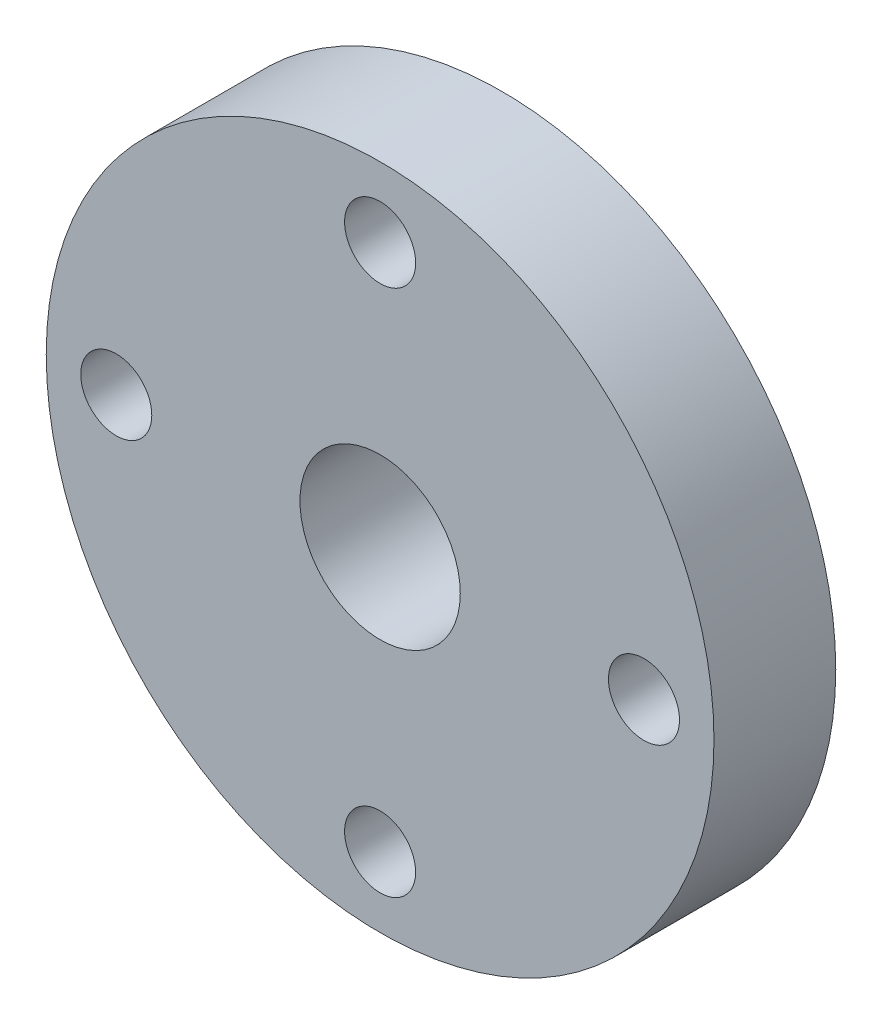
from build123d import *

# Parameters (mm, degrees)
SKETCH1_R           = 16.4
SKETCH1_R_2         = 4
SKETCH1_R_3         = 1.8
BOSS_EXTRUDE1_DEPTH = 6
MOVE_FACE1_BY       = 0.05
MOVE_FACE1_2_BY     = 0.05
MOVE_FACE1_3_BY     = 0.05
MOVE_FACE1_4_BY     = 0.05
MOVE_FACE1_5_BY     = 0.05
MOVE_FACE1_6_BY     = 0.05


with BuildPart() as part:
    # Sketch1 → Boss-Extrude1 (new body)
    with BuildSketch(Plane.XY):
        Circle(SKETCH1_R)
        Circle(SKETCH1_R_2, mode=Mode.SUBTRACT)
        with Locations((0, 13)):
            Circle(SKETCH1_R_3, mode=Mode.SUBTRACT)
        with Locations((13, 0)):
            Circle(SKETCH1_R_3, mode=Mode.SUBTRACT)
        with Locations((0, -13)):
            Circle(SKETCH1_R_3, mode=Mode.SUBTRACT)
        with Locations((-13, 0)):
            Circle(SKETCH1_R_3, mode=Mode.SUBTRACT)
    extrude(amount=BOSS_EXTRUDE1_DEPTH)

    # Move Face1: a curved face moved outward by 0.05
    add(Solid.thicken(part.faces().sort_by_distance((-1.8, 13, 3))[0], MOVE_FACE1_BY))

    # Move Face1 2: a curved face moved outward by 0.05
    add(Solid.thicken(part.faces().sort_by_distance((-16.4, 0, 3))[0], MOVE_FACE1_2_BY))

    # Move Face1 3: a curved face moved outward by 0.05
    add(Solid.thicken(part.faces().sort_by_distance((-4, 0, 3))[0], MOVE_FACE1_3_BY))

    # Move Face1 4: a curved face moved outward by 0.05
    add(Solid.thicken(part.faces().sort_by_distance((11.2, 0, 3))[0], MOVE_FACE1_4_BY))

    # Move Face1 5: a curved face moved outward by 0.05
    add(Solid.thicken(part.faces().sort_by_distance((-1.8, -13, 3))[0], MOVE_FACE1_5_BY))

    # Move Face1 6: a curved face moved outward by 0.05
    add(Solid.thicken(part.faces().sort_by_distance((-14.8, 0, 3))[0], MOVE_FACE1_6_BY))


solid = part.part
